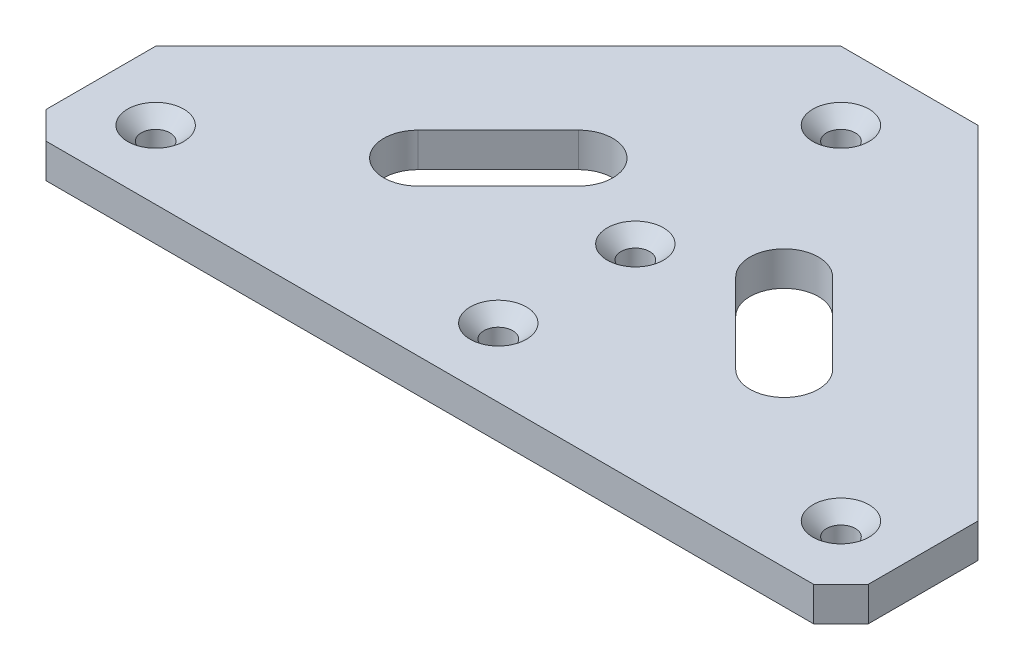
from build123d import *

# Parameters (mm, degrees)
SKETCH_2_R          = 2.1
EXTRUDE_1_DEPTH     = 2.5
CHAMFER_1_SIZE      = 2
CHAMFER_2_SIZE      = 4
CUT_EXTRUDE_1_DEPTH = 70.641941386


with BuildPart() as part:
    # 草图2 → 凸台-拉伸1 (new, symmetric)
    with BuildSketch(Plane(origin=(0, 0, 0), x_dir=(1, 0, 0), z_dir=(0, 1, 0))):
        Polygon((0, 35), (-10, 35), (-60, -15), (-60, -35), (60, -35), (60, -15), (10, 35), align=None)
        with Locations(Location((-50, -25, 0), (0, 0, 270))):
            Circle(SKETCH_2_R, mode=Mode.SUBTRACT)
        with Locations(Location((0, 25, 0), (0, 0, 270))):
            Circle(SKETCH_2_R, mode=Mode.SUBTRACT)
        with Locations(Location((0, -5, 0), (0, 0, 270))):
            Circle(SKETCH_2_R, mode=Mode.SUBTRACT)
        with Locations(Location((0, -25, 0), (0, 0, 270))):
            Circle(SKETCH_2_R, mode=Mode.SUBTRACT)
        with Locations(Location((50, -25, 0), (0, 0, 90))):
            Circle(SKETCH_2_R, mode=Mode.SUBTRACT)
    extrude(amount=EXTRUDE_1_DEPTH, both=True)

    # 倒角1
    chamfer_1_edges = [part.edges().sort_by_distance(p)[0] for p in [
        (-50, 2.5, 22.9),
        (0, 2.5, -27.1),
        (0, 2.5, 2.9),
        (0, 2.5, 22.9),
        (50, 2.5, 27.1),
    ]]
    chamfer(chamfer_1_edges, length=CHAMFER_1_SIZE)

    # 倒角2
    chamfer_2_edges = [part.edges().sort_by_distance(p)[0] for p in [
        (60, 0, 35),
        (-60, 0, 35),
    ]]
    chamfer(chamfer_2_edges, length=CHAMFER_2_SIZE)

    # 草图3 → 切除-拉伸1 (cut, through all)
    with BuildSketch(Plane(origin=(0, 2.5, 0), x_dir=(1, 0, 0), z_dir=(0, 1, 0))):
        with BuildLine():
            Line((-30.251262658, -6.464466094), (-18.535533906, 5.251262658))
            ThreePointArc((-18.535533906, 5.251262658), (-11.464466094, 5.251262658), (-11.464466094, -1.819805153))
            Line((-11.464466094, -1.819805153), (-23.180194847, -13.535533906))
            ThreePointArc((-23.180194847, -13.535533906), (-30.251262658, -13.535533906), (-30.251262658, -6.464466094))
        make_face()
        with BuildLine():
            Line((30.251262658, -6.464466094), (18.535533906, 5.251262658))
            ThreePointArc((18.535533906, 5.251262658), (11.464466094, 5.251262658), (11.464466094, -1.819805153))
            Line((11.464466094, -1.819805153), (23.180194847, -13.535533906))
            ThreePointArc((23.180194847, -13.535533906), (30.251262658, -13.535533906), (30.251262658, -6.464466094))
        make_face()
    extrude(amount=-CUT_EXTRUDE_1_DEPTH, mode=Mode.SUBTRACT)


solid = part.part
